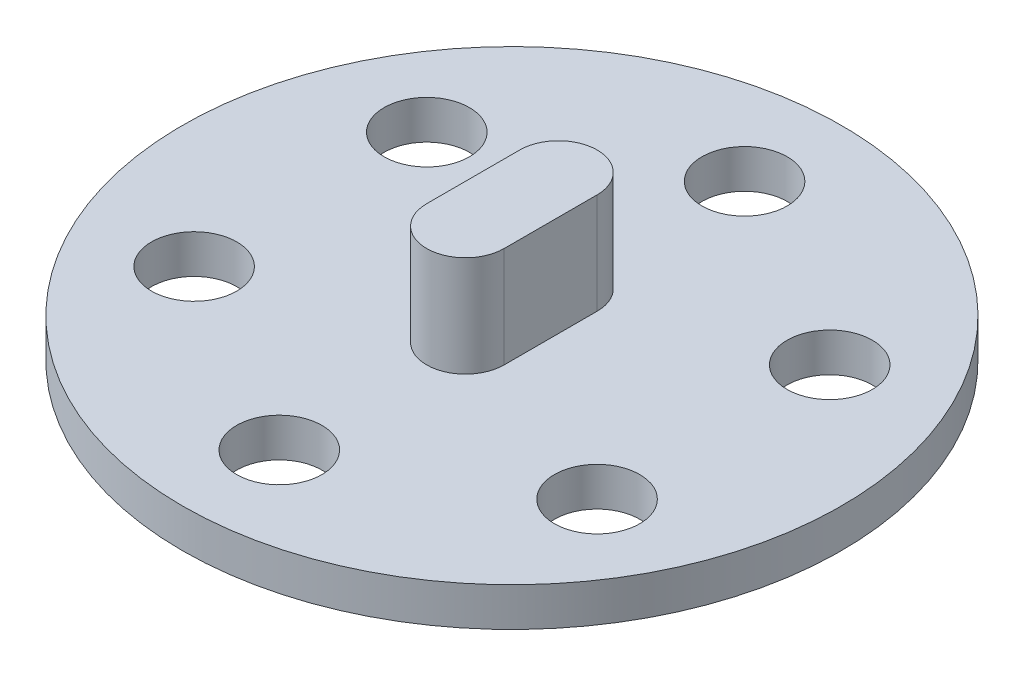
from build123d import *

# Parameters (mm, degrees)
SKETCH1_R           = 42.5
SKETCH1_R_2         = 5.5
BOSS_EXTRUDE2_DEPTH = 5
BOSS_EXTRUDE3_DEPTH = 13


with BuildPart() as part:
    # Sketch1 → Boss-Extrude2 (new body)
    with BuildSketch(Plane(origin=(0, 0, 0), x_dir=(1, 0, 0), z_dir=(0, 1, 0))):
        with Locations(Location((0, 0, 0), (0, 0, 270))):
            Circle(SKETCH1_R)
        with Locations(Location((-25.980762114, 15, 0), (0, 0, 270))):
            Circle(SKETCH1_R_2, mode=Mode.SUBTRACT)
        with Locations(Location((0, 30, 0), (0, 0, 270))):
            Circle(SKETCH1_R_2, mode=Mode.SUBTRACT)
        with Locations(Location((25.980762114, 15, 0), (0, 0, 270))):
            Circle(SKETCH1_R_2, mode=Mode.SUBTRACT)
        with Locations(Location((25.980762114, -15, 0), (0, 0, 270))):
            Circle(SKETCH1_R_2, mode=Mode.SUBTRACT)
        with Locations(Location((0, -30, 0), (0, 0, 270))):
            Circle(SKETCH1_R_2, mode=Mode.SUBTRACT)
        with Locations(Location((-25.980762114, -15, 0), (0, 0, 270))):
            Circle(SKETCH1_R_2, mode=Mode.SUBTRACT)
    extrude(amount=BOSS_EXTRUDE2_DEPTH)

    # Sketch2 → Boss-Extrude3 (add)
    with BuildSketch(Plane(origin=(0, 5, 0), x_dir=(1, 0, 0), z_dir=(0, 1, 0))):
        with BuildLine():
            Line((-5, -6), (-5, 6))
            ThreePointArc((-5, 6), (0, 11), (5, 6))
            Line((5, 6), (5, -6))
            ThreePointArc((5, -6), (0, -11), (-5, -6))
        make_face()
    extrude(amount=BOSS_EXTRUDE3_DEPTH)


solid = part.part
